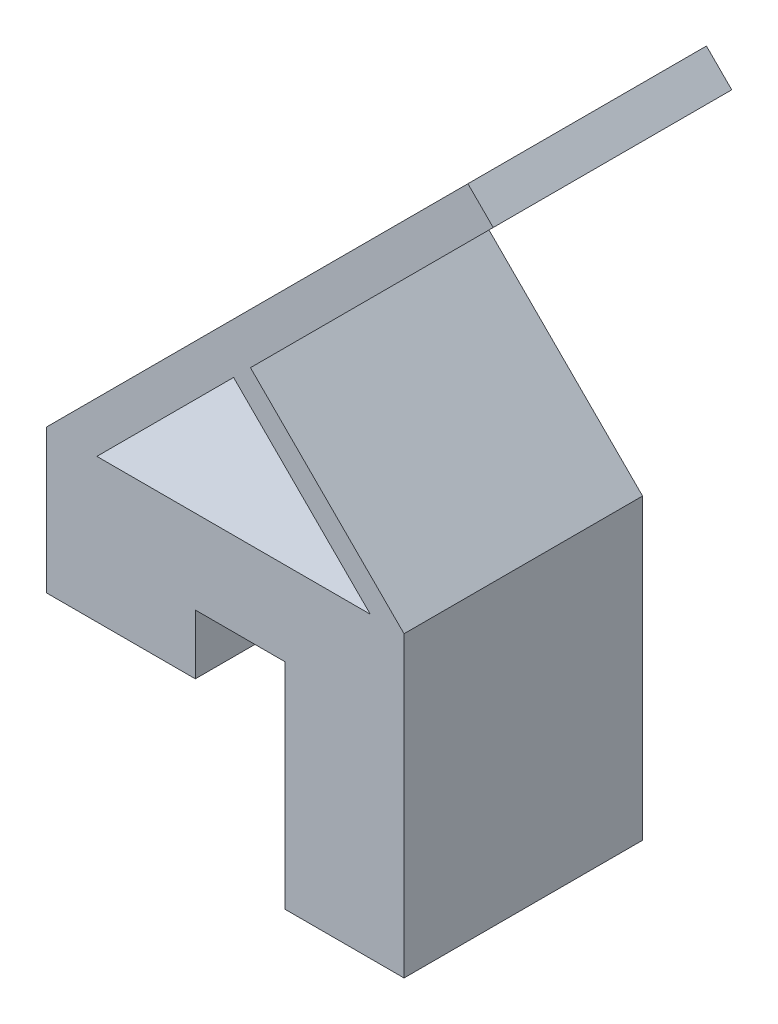
from build123d import *

# Parameters (mm, degrees)
BOSS_EXTRUDE2_DEPTH = 20
BOSS_EXTRUDE3_DEPTH = 20


with BuildPart() as part:
    # Sketch1 → Boss-Extrude2 (new body)
    with BuildSketch(Plane.XY):
        Polygon((-2.274774775, 3.513513514), (-14.774774775, 3.513513514), (-14.774774775, 15.540540541), (5.225225225, 15.540540541), (15.225225225, 15.540540541), (15.225225225, -9.459459459), (5.225225225, -9.459459459), (5.225225225, 8.513513514), (-2.274774775, 8.513513514), align=None)
    extrude(amount=BOSS_EXTRUDE2_DEPTH)

    # Sketch2 → Boss-Extrude3 (add)
    with BuildSketch(Plane.XY.offset(20)):
        Polygon((-14.774774775, 15.540540541), (20.580564285, 50.8958796), (22.701884628, 48.774559256), (2.346545569, 28.419220197), (15.225225225, 15.540540541), (12.3967981, 15.540540541), (0.932332006, 27.005006635), (-10.532134088, 15.540540541), align=None)
    extrude(amount=-BOSS_EXTRUDE3_DEPTH)


solid = part.part
